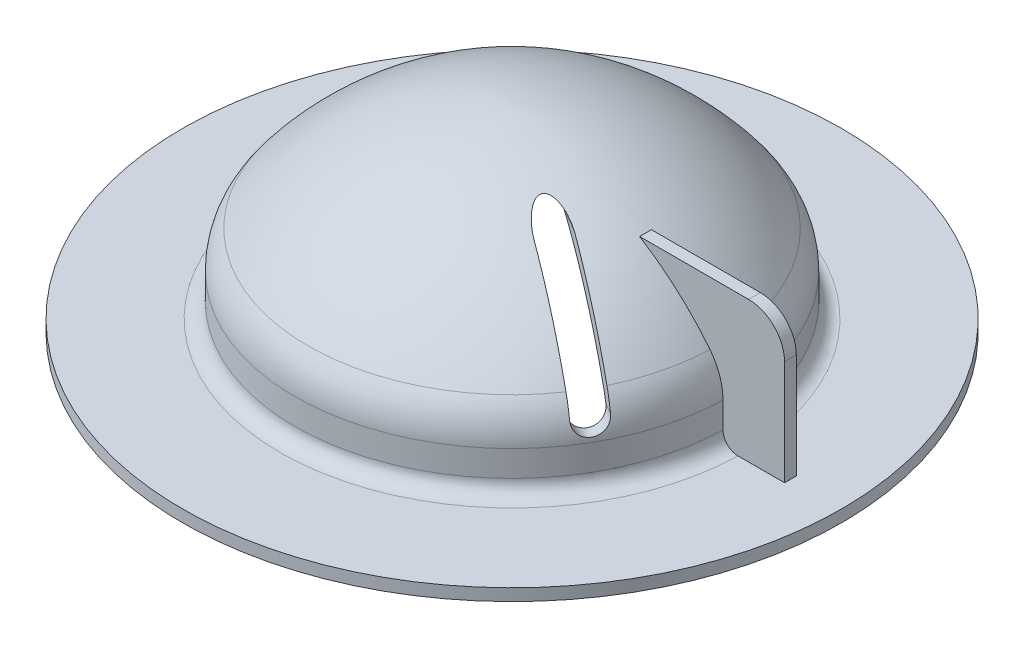
from build123d import *

# Parameters (mm, degrees)
EXTRUDE4_REACH = 150.66
SKETCH4_W      = 2.487678434
SKETCH4_H      = 29.822327244
FILLET1_R      = 7.62
EXTRUDE5_DEPTH = 74.422


with BuildPart() as part:
    # Sketch1 → Revolve1 (revolve)
    with BuildSketch(Plane.XY, mode=Mode.PRIVATE) as revolve1_sk:
        with BuildLine():
            Line((49.097749482, -15.326788155), (69.775027386, -15.326788155))
            Line((69.775027386, -15.326788155), (69.775027386, -12.786788155))
            Line((69.775027386, -12.786788155), (49.097749482, -12.786788155))
            ThreePointArc((49.097749482, -12.786788155), (46.852685451, -11.856852185), (45.922749482, -9.611788155))
            Line((45.922749482, -9.611788155), (45.922749482, -4.138825948))
            ThreePointArc((45.922749482, -4.138825948), (45.211742017, 0.050930369), (43.1583309, 3.771561014))
            ThreePointArc((43.1583309, 3.771561014), (23.9640002, 19.463782507), (0, 25.819476082))
            Line((0, 25.819476082), (0, 23.276639751))
            ThreePointArc((0, 23.276639751), (22.860743769, 17.175108349), (41.171214616, 2.189483621))
            ThreePointArc((41.171214616, 2.189483621), (42.81394351, -0.787020895), (43.382749482, -4.138825948))
            Line((43.382749482, -4.138825948), (43.382749482, -9.611788155))
            ThreePointArc((43.382749482, -9.611788155), (45.056634227, -13.652903409), (49.097749482, -15.326788155))
        make_face()
    revolve(revolve1_sk.sketch.rotate(Axis((0, 0, 0), (0, 1, 0)), 90), axis=Axis((0, 0, 0), (0, 1, 0)))

    # Sketch4 → Extrude4 (add, up to next)
    with BuildSketch(Plane(origin=(58.928, 0, 0), x_dir=(0, 0, -1), z_dir=(1, 0, 0)), mode=Mode.PRIVATE) as extrude4_sk1:
        with Locations((0, 2.124375467)):
            Rectangle(SKETCH4_W, SKETCH4_H)
    extrude4_tool1 = extrude(extrude4_sk1.sketch, amount=-EXTRUDE4_REACH, mode=Mode.PRIVATE) - part.part
    add(extrude4_tool1.solids().sort_by_distance((58.928, 2.124375, 0))[0])

    # Fillet1
    fillet1_edges = [part.edges().sort_by_distance(p)[0] for p in [
        (58.928, 17.035539089, 0),
    ]]
    fillet(fillet1_edges, radius=FILLET1_R)

    # Sketch8 → Extrude5 (cut)
    with BuildSketch(Plane(origin=(76.143573953, 0, 43.961512919), x_dir=(0.500000000000001, 0, -0.8660254037844382), z_dir=(0.8660254037844382, 0, 0.500000000000001))):
        with BuildLine():
            Line((3.175, 0), (3.175, 19.05))
            ThreePointArc((3.175, 19.05), (0, 22.225), (-3.175, 19.05))
            Line((-3.175, 19.05), (-3.175, 0))
            ThreePointArc((-3.175, 0), (0, -3.175), (3.175, 0))
        make_face()
    extrude(amount=-EXTRUDE5_DEPTH, mode=Mode.SUBTRACT)


solid = part.part
